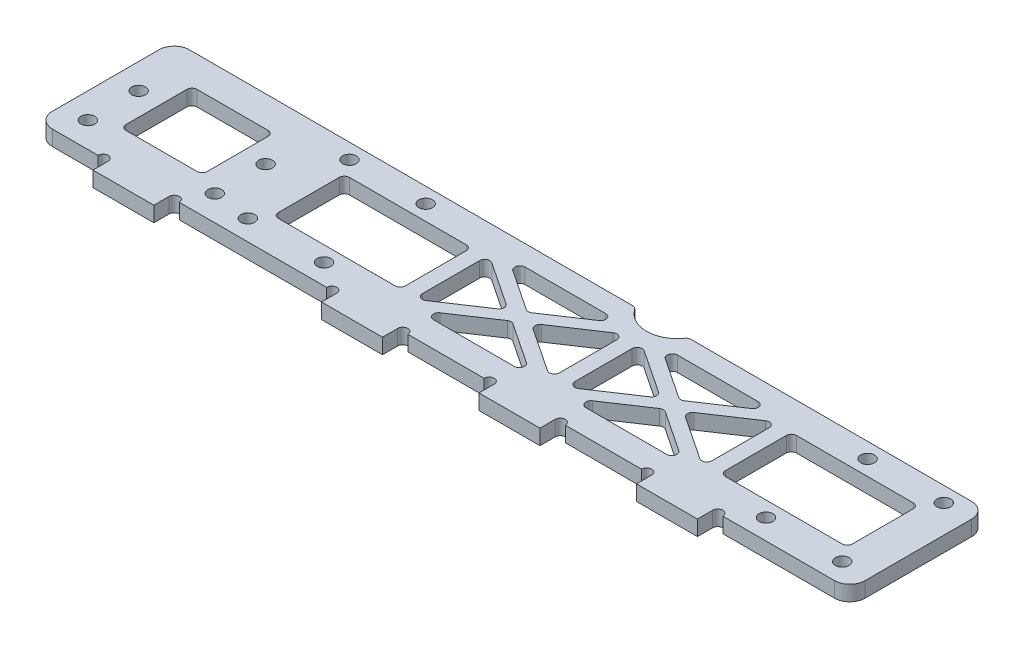
from build123d import *

# Parameters (mm, degrees)
SKETCH_1_W          = 160
SKETCH_1_H          = 27
EXTRUDE_1_DEPTH     = 3
SKETCH_2_R          = 1.35
SKETCH_2_W          = 25
SKETCH_2_H          = 14
CUT_EXTRUDE_2_DEPTH = 82.186513658
FILLET_1_R          = 1
SKETCH_3_W          = 12
SKETCH_3_H          = 3
EXTRUDE_2_DEPTH     = 3
SKETCH_4_R          = 1
CUT_EXTRUDE_4_DEPTH = 82.738913621
FILLET_2_R          = 3
SKETCH_6_R          = 1.35
CUT_EXTRUDE_6_DEPTH = 82.738913621
SKETCH_5_W          = 16
SKETCH_5_H          = 14
CUT_EXTRUDE_5_DEPTH = 82.738913621
SKETCH_7_R          = 6
CUT_EXTRUDE_7_DEPTH = 82.738913621
FILLET_3_R          = 1


with BuildPart() as part:
    # 草图1 → 凸台-拉伸1 (new body)
    with BuildSketch(Plane(origin=(0, 0, 0), x_dir=(1, 0, 0), z_dir=(0, 1, 0))):
        Rectangle(SKETCH_1_W, SKETCH_1_H)
    extrude(amount=EXTRUDE_1_DEPTH)

    # 草图2 → 切除-拉伸2 (cut, through all)
    with BuildSketch(Plane(origin=(0, 3, 0), x_dir=(1, 0, 0), z_dir=(0, 1, 0))):
        with Locations(Location((74.5, 10.5, 0), (0, 0, 270))):
            Circle(SKETCH_2_R)
        with Locations(Location((74.5, -9.5, 0), (0, 0, 90))):
            Circle(SKETCH_2_R)
        with Locations(Location((59.5, -9.5, 0), (0, 0, 270))):
            Circle(SKETCH_2_R)
        with Locations(Location((59.5, 10.5, 0), (0, 0, 90))):
            Circle(SKETCH_2_R)
        with Locations(Location((-27.5, -9.5, 0), (0, 0, 90))):
            Circle(SKETCH_2_R)
        with Locations(Location((-42.5, -9.5, 0), (0, 0, 270))):
            Circle(SKETCH_2_R)
        with Locations(Location((-42.5, 10.5, 0), (0, 0, 90))):
            Circle(SKETCH_2_R)
        with Locations(Location((-27.5, 10.5, 0), (0, 0, 270))):
            Circle(SKETCH_2_R)
        with Locations((60, 0.5)):
            Rectangle(SKETCH_2_W, SKETCH_2_H)
        with Locations((-28, 0.5)):
            Rectangle(SKETCH_2_W, SKETCH_2_H)
    extrude(amount=-CUT_EXTRUDE_2_DEPTH, mode=Mode.SUBTRACT)

    # 圆角1
    fillet_1_edges = [part.edges().sort_by_distance(p)[0] for p in [
        (-15.5, 1.5, -7.5),
        (-15.5, 1.5, 6.5),
        (-40.5, 1.5, 6.5),
        (-40.5, 1.5, -7.5),
        (72.5, 1.5, -7.5),
        (72.5, 1.5, 6.5),
        (47.5, 1.5, 6.5),
        (47.5, 1.5, -7.5),
    ]]
    fillet(fillet_1_edges, radius=FILLET_1_R)

    # 草图3 → 凸台-拉伸2 (add)
    with BuildSketch(Plane.XZ):
        with Locations((47, 15)):
            Rectangle(SKETCH_3_W, SKETCH_3_H)
        with Locations((-15, 15)):
            Rectangle(SKETCH_3_W, SKETCH_3_H)
        with Locations((16, 15)):
            Rectangle(SKETCH_3_W, SKETCH_3_H)
        with Locations((-60, 15)):
            Rectangle(SKETCH_3_W, SKETCH_3_H)
    extrude(amount=-EXTRUDE_2_DEPTH)

    # 草图4 → 切除-拉伸4 (cut, through all)
    with BuildSketch(Plane.XZ):
        with Locations((54, 13.5)):
            Circle(SKETCH_4_R)
        with Locations((40, 13.5)):
            Circle(SKETCH_4_R)
        with Locations((23, 13.5)):
            Circle(SKETCH_4_R)
        with Locations((9, 13.5)):
            Circle(SKETCH_4_R)
        with Locations((-8, 13.5)):
            Circle(SKETCH_4_R)
        with Locations((-22, 13.5)):
            Circle(SKETCH_4_R)
        with Locations((-53, 13.5)):
            Circle(SKETCH_4_R)
        with Locations((-67, 13.5)):
            Circle(SKETCH_4_R)
    extrude(amount=-CUT_EXTRUDE_4_DEPTH, mode=Mode.SUBTRACT)

    # 圆角2
    fillet_2_edges = [part.edges().sort_by_distance(p)[0] for p in [
        (80, 1.5, 13.5),
        (-80, 1.5, 13.5),
        (-80, 1.5, -13.5),
        (80, 1.5, -13.5),
    ]]
    fillet(fillet_2_edges, radius=FILLET_2_R)

    # 草图6 → 切除-拉伸6 (cut, through all)
    with BuildSketch(Plane.XZ):
        with Locations(Location((-75, -1.5, 0), (0, 0, 270))):
            Circle(SKETCH_6_R)
        with Locations(Location((-75, 8.5, 0), (0, 0, 270))):
            Circle(SKETCH_6_R)
        with Locations(Location((-50, -1.5, 0), (0, 0, 270))):
            Circle(SKETCH_6_R)
        with Locations(Location((-50, 8.5, 0), (0, 0, 270))):
            Circle(SKETCH_6_R)
    extrude(amount=-CUT_EXTRUDE_6_DEPTH, mode=Mode.SUBTRACT)

    # 草图5 → 切除-拉伸5 (cut, through all)
    with BuildSketch(Plane.XZ):
        Polygon((42.246530453, -9.5), (31, -2.002313031), (19.753469547, -9.5), align=None)
        Polygon((44.5, -7.997686969), (44.5, 6.997686969), (33.253469547, -0.5), align=None)
        Polygon((31, 1.002313031), (19.753469547, 8.5), (42.246530453, 8.5), align=None)
        Polygon((17.5, 6.997686969), (28.746530453, -0.5), (17.5, -7.997686969), align=None)
        Polygon((14.5, -7.997686969), (14.5, 6.997686969), (3.253469547, -0.5), align=None)
        Polygon((-12.5, 6.997686969), (-1.253469547, -0.5), (-12.5, -7.997686969), align=None)
        Polygon((-10.246530453, 8.5), (1, 1.002313031), (12.246530453, 8.5), align=None)
        Polygon((1, -2.002313031), (12.246530453, -9.5), (-10.246530453, -9.5), align=None)
        with Locations((-62.5, -0.5)):
            Rectangle(SKETCH_5_W, SKETCH_5_H)
    extrude(amount=-CUT_EXTRUDE_5_DEPTH, mode=Mode.SUBTRACT)

    # 草图7 → 切除-拉伸7 (cut, through all)
    with BuildSketch(Plane.XZ):
        with Locations((16, -16.5)):
            Circle(SKETCH_7_R)
    extrude(amount=-CUT_EXTRUDE_7_DEPTH, mode=Mode.SUBTRACT)

    # 圆角3
    fillet_3_edges = [part.edges().sort_by_distance(p)[0] for p in [
        (14.5, 1.5, -7.997686969),
        (3.253469547, 1.5, -0.5),
        (14.5, 1.5, 6.997686969),
        (17.5, 1.5, -7.997686969),
        (17.5, 1.5, 6.997686969),
        (28.746530453, 1.5, -0.5),
        (44.5, 1.5, -7.997686969),
        (33.253469547, 1.5, -0.5),
        (44.5, 1.5, 6.997686969),
        (42.246530453, 1.5, 8.5),
        (31, 1.5, 1.002313031),
        (19.753469547, 1.5, 8.5),
        (-54.5, 1.5, 6.5),
        (-54.5, 1.5, -7.5),
        (-70.5, 1.5, -7.5),
        (-70.5, 1.5, 6.5),
        (-10.246530453, 1.5, -9.5),
        (1, 1.5, -2.002313031),
        (12.246530453, 1.5, -9.5),
        (-12.5, 1.5, -7.997686969),
        (-12.5, 1.5, 6.997686969),
        (-1.253469547, 1.5, -0.5),
        (-10.246530453, 1.5, 8.5),
        (12.246530453, 1.5, 8.5),
        (1, 1.5, 1.002313031),
        (42.246530453, 1.5, -9.5),
        (19.753469547, 1.5, -9.5),
        (31, 1.5, -2.002313031),
        (10.803847577, 1.5, -13.5),
        (21.196152423, 1.5, -13.5),
    ]]
    fillet(fillet_3_edges, radius=FILLET_3_R)


solid = part.part
